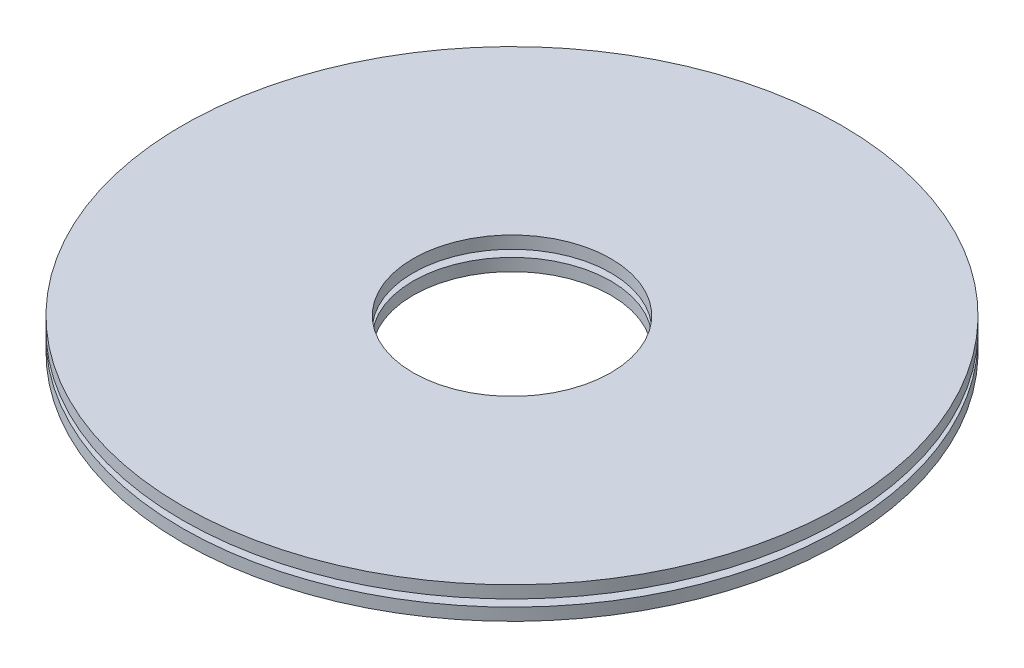
from build123d import *

# Parameters (mm, degrees)
SKETCH1_R          = 762
BOTTOMTABLE_DEPTH  = 28.575
SKETCH2_R          = 762
TOPTABLE_DEPTH     = 28.575
CUT_EXTRUDE1_START = -73.406
SKETCH3_R          = 228.6
CUT_EXTRUDE1_DEPTH = 73.406


with BuildPart() as part:
    # Sketch1 → bottomTable (new body)
    with BuildSketch(Plane(origin=(0, 0, 0), x_dir=(1, 0, 0), z_dir=(0, 1, 0))):
        with Locations(Location((0, 0, 0), (0, 0, 270))):
            Circle(SKETCH1_R)
    extrude(amount=BOTTOMTABLE_DEPTH)


with BuildPart() as body_2:
    # Sketch2 → topTable (new body)
    with BuildSketch(Plane(origin=(0, 44.831, 0), x_dir=(1, 0, 0), z_dir=(0, 1, 0))):
        with Locations(Location((0, 0, 0), (0, 0, 270))):
            Circle(SKETCH2_R)
    extrude(amount=TOPTABLE_DEPTH)


with BuildPart() as cut_extrude1_tool:
    # Sketch3 → Cut-Extrude1 (new body)
    with BuildSketch(Plane(origin=(0, 73.406, 0), x_dir=(1, 0, 0), z_dir=(0, 1, 0)).offset(CUT_EXTRUDE1_START)):
        with Locations(Location((0, 0, 0), (0, 0, 270))):
            Circle(SKETCH3_R)
    extrude(amount=CUT_EXTRUDE1_DEPTH)


with BuildPart() as part_1:
    add(part.part)

    # Cut-Extrude1: cut by cut_extrude1_tool
    add(cut_extrude1_tool.part, mode=Mode.SUBTRACT)


with BuildPart() as body_2_1:
    add(body_2.part)

    # Cut-Extrude1: cut by cut_extrude1_tool
    add(cut_extrude1_tool.part, mode=Mode.SUBTRACT)


solid = Compound([part_1.part, body_2_1.part])
